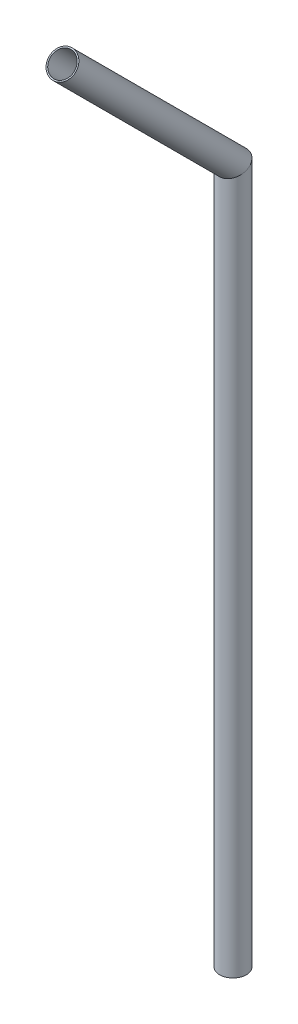
from build123d import *

# Parameters (mm, degrees)
ESBO_O1_R   = 10
ESBO_O1_R_2 = 9


with BuildPart() as part:
    # Varredura1: sweep along a path in Esboço2
    with BuildLine(Plane(origin=(0, 0, 0), x_dir=(0, 0, -1), z_dir=(1, 0, 0))) as varredura1_path:
        Line((0, 0), (0, 520))
        Line((0, 520), (-127.279220614, 647.279220614))
    # Esboço1 → Varredura1 (sweep)
    with BuildSketch(Plane(origin=(0, 0, 0), x_dir=(1, 0, 0), z_dir=(0, 1, 0))):
        Circle(ESBO_O1_R)
        Circle(ESBO_O1_R_2, mode=Mode.SUBTRACT)
    sweep(path=varredura1_path.line, transition=Transition.RIGHT)


solid = part.part
